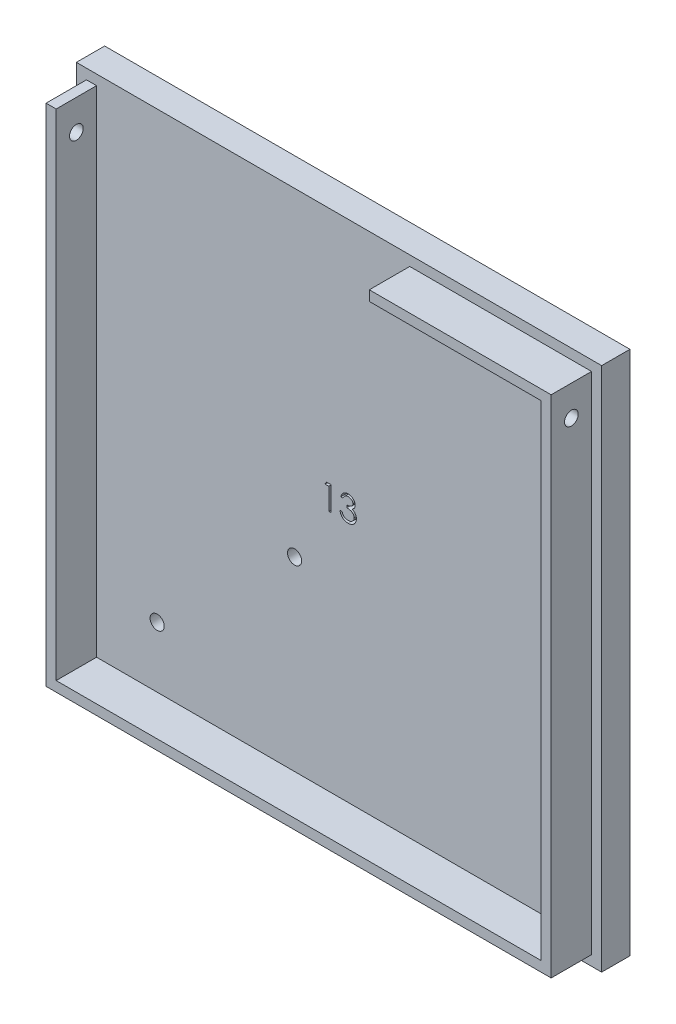
from build123d import *

# Parameters (mm, degrees)
CROQUIS1_W              = 130
CROQUIS1_H              = 130
CROQUIS1_R              = 1.75
CROQUIS1_R_2            = 2.25
SALIENTE_EXTRUIR1_DEPTH = 7
CORTAR_EXTRUIR1_DEPTH   = 2
CROQUIS4_W              = 125
CROQUIS4_H              = 125
CROQUIS4_W_2            = 120
CROQUIS4_H_2            = 120
SALIENTE_EXTRUIR2_DEPTH = 10
CROQUIS6_R              = 1.7
CORTAR_EXTRUIR2_DEPTH   = 145.118874545
CORTAR_EXTRUIR3_REACH   = 146.119
CROQUIS7_W              = 77.5
CROQUIS7_H              = 10


with BuildPart() as part:
    # Croquis1 → Saliente-Extruir1 (new body)
    with BuildSketch(Plane.XY):
        Rectangle(CROQUIS1_W, CROQUIS1_H)
        with Locations((-11, -14)):
            Circle(CROQUIS1_R, mode=Mode.SUBTRACT)
        with Locations((-45, -45)):
            Circle(CROQUIS1_R, mode=Mode.SUBTRACT)
        with Locations((55, 45)):
            Circle(CROQUIS1_R_2, mode=Mode.SUBTRACT)
        with Locations((55, -45)):
            Circle(CROQUIS1_R_2, mode=Mode.SUBTRACT)
    extrude(amount=SALIENTE_EXTRUIR1_DEPTH)

    # Croquis2 → Cortar-Extruir1 (cut)
    with BuildSketch(Plane.XY.offset(7)):
        Polygon((-3.109375, 6), (-2, 6), (-2, 0), (-2.538461538, 0), (-2.538461538, 5.384615385), (-3.461538462, 5.384615385), align=None)
        with BuildLine():
            Line((1, 4.615384615), (0.461538462, 4.615384615))
            add(Edge.make_bspline(
                [(0.461538462, 4.615384615), (0.476126263, 4.675783159), (0.504644221, 4.793857373), (0.564125775, 4.962555534), (0.628924499, 5.122195856), (0.706734392, 5.269789126), (0.791606542, 5.40830153), (0.888845493, 5.534591458), (0.993965018, 5.651870827), (1.110236359, 5.755950663), (1.232171208, 5.850198199), (1.361487699, 5.93055544), (1.495584088, 5.999682559), (1.635389459, 6.056631528), (1.781320039, 6.099532426), (1.932056536, 6.130658378), (2.087993965, 6.150871717), (2.193846977, 6.152844454), (2.247596154, 6.153846154)],
                knots=[0, 0, 0, 0, 1.162005537, 2.271625781, 3.343758855, 4.383309926, 5.390229558, 6.379919256, 7.361854164, 8.333198761, 9.295911338, 10.242430842, 11.177959212, 12.116337295, 13.062827104, 14.020064771, 14.994644689, 16, 16, 16, 16], degree=3))
            add(Edge.make_bspline(
                [(2.247596154, 6.153846154), (2.325909426, 6.151481759), (2.48082773, 6.146804544), (2.708421525, 6.104094082), (2.927896072, 6.03650814), (3.136849069, 5.943124608), (3.33093781, 5.827946357), (3.503628416, 5.690863951), (3.652580149, 5.534522291), (3.777541939, 5.361837895), (3.875384795, 5.177285593), (3.947532863, 4.987342467), (3.991455745, 4.792459087), (3.997148128, 4.66087518), (4, 4.594951923)],
                knots=[0, 0, 0, 0, 1.083050992, 2.142477498, 3.193116406, 4.255571735, 5.30263384, 6.308962982, 7.297363603, 8.282367274, 9.249857812, 10.179914175, 11.08814088, 12, 12, 12, 12], degree=3))
            add(Edge.make_bspline(
                [(4, 4.594951923), (3.998005272, 4.531511704), (3.9941019, 4.407369039), (3.960958405, 4.226132187), (3.905181954, 4.055318015), (3.827919504, 3.894207451), (3.727905418, 3.743822011), (3.606752223, 3.603823341), (3.463604803, 3.473590499), (3.355126624, 3.398985688), (3.299278846, 3.360576923)],
                knots=[0, 0, 0, 0, 1.024540389, 2.004866551, 2.965041327, 3.920577974, 4.882998113, 5.874504559, 6.905732034, 8, 8, 8, 8], degree=3))
            add(Edge.make_bspline(
                [(3.299278846, 3.360576923), (3.363104711, 3.3297572), (3.48956221, 3.268694416), (3.661934546, 3.148941689), (3.818410904, 3.010673665), (3.905674422, 2.902771974), (3.949519231, 2.848557692)],
                knots=[0, 0, 0, 0, 1.015518401, 2.012035669, 3.001164323, 4, 4, 4, 4], degree=3))
            add(Edge.make_bspline(
                [(3.949519231, 2.848557692), (3.978390103, 2.809030118), (4.035659068, 2.730622261), (4.106348554, 2.604559817), (4.170478465, 2.477100121), (4.220450269, 2.344826853), (4.259148327, 2.209273116), (4.286810096, 2.070206151), (4.303994338, 1.927512398), (4.306455284, 1.830976718), (4.307692308, 1.782451923)],
                knots=[0, 0, 0, 0, 1.025084078, 2.033381695, 3.024893161, 4.013698104, 4.991890475, 5.976764909, 6.982997093, 8, 8, 8, 8], degree=3))
            add(Edge.make_bspline(
                [(4.307692308, 1.782451923), (4.304615999, 1.698435258), (4.298477858, 1.530797312), (4.243613731, 1.283126361), (4.158562461, 1.0410255), (4.037779142, 0.809468632), (3.890577699, 0.592816551), (3.715450857, 0.39897145), (3.514388443, 0.232345271), (3.290150187, 0.093127737), (3.047206539, -0.01816013), (2.787362667, -0.09540146), (2.514362574, -0.145708888), (2.327150064, -0.151103521), (2.231971154, -0.153846154)],
                knots=[0, 0, 0, 0, 0.955779014, 1.907060117, 2.875433937, 3.871313158, 4.872415639, 5.851225146, 6.836215519, 7.83643374, 8.849228613, 9.86973379, 10.916971861, 12, 12, 12, 12], degree=3))
            add(Edge.make_bspline(
                [(2.231971154, -0.153846154), (2.167823782, -0.152357788), (2.041603145, -0.149429181), (1.856042862, -0.129408722), (1.678919949, -0.092842999), (1.509994924, -0.043637332), (1.349117718, 0.018748511), (1.196779252, 0.096437708), (1.052042292, 0.187828854), (0.916272662, 0.294000719), (0.789486545, 0.41276873), (0.675053304, 0.546241319), (0.571065087, 0.691951154), (0.480306278, 0.851590679), (0.398642931, 1.023096834), (0.331475577, 1.208665688), (0.272357459, 1.406638298), (0.24487152, 1.544600138), (0.230769231, 1.615384615)],
                knots=[0, 0, 0, 0, 1.048658725, 2.063410685, 3.046034179, 4.001477787, 4.936774919, 5.862367409, 6.792675028, 7.730719943, 8.675894397, 9.627829632, 10.600096036, 11.597688215, 12.626045268, 13.701542398, 14.82072376, 16, 16, 16, 16], degree=3))
            Line((0.230769231, 1.615384615), (0.769230769, 1.615384615))
            add(Edge.make_bspline(
                [(0.769230769, 1.615384615), (0.783259269, 1.569186307), (0.810545919, 1.479326584), (0.856993287, 1.350000346), (0.909910325, 1.231443683), (0.96667814, 1.122786903), (1.026298333, 1.022959927), (1.093009633, 0.934602437), (1.161871025, 0.853833519), (1.213778488, 0.80832847), (1.239182692, 0.786057692)],
                knots=[0, 0, 0, 0, 1.198163088, 2.33053128, 3.407730985, 4.417276592, 5.372219308, 6.28897303, 7.162600585, 8, 8, 8, 8], degree=3))
            add(Edge.make_bspline(
                [(1.239182692, 0.786057692), (1.272776823, 0.760157691), (1.339861388, 0.708437637), (1.449178356, 0.642434845), (1.564146732, 0.585244516), (1.687257602, 0.54155818), (1.815854352, 0.504567905), (1.952015549, 0.480361301), (2.094539921, 0.463753007), (2.191856087, 0.46228741), (2.241586538, 0.461538462)],
                knots=[0, 0, 0, 0, 0.946170439, 1.889420265, 2.845303464, 3.807233317, 4.801018734, 5.828864929, 6.890507805, 8, 8, 8, 8], degree=3))
            add(Edge.make_bspline(
                [(2.241586538, 0.461538462), (2.2977354, 0.462594299), (2.407529652, 0.464658898), (2.567737982, 0.483645824), (2.72015075, 0.511297962), (2.863075765, 0.554005932), (2.998385206, 0.606773106), (3.12418232, 0.673027515), (3.242118502, 0.750761324), (3.350683197, 0.839114167), (3.448304067, 0.93583673), (3.534257518, 1.037001995), (3.607328367, 1.142183417), (3.666271643, 1.251963053), (3.712815444, 1.365886303), (3.744500931, 1.484272867), (3.766532099, 1.606153895), (3.768326292, 1.689003556), (3.769230769, 1.730769231)],
                knots=[0, 0, 0, 0, 1.217147791, 2.380027433, 3.494444702, 4.572153297, 5.609568379, 6.639424714, 7.649109417, 8.668170816, 9.669597737, 10.625200337, 11.543417969, 12.441394052, 13.322311151, 14.205496177, 15.095365482, 16, 16, 16, 16], degree=3))
            add(Edge.make_bspline(
                [(3.769230769, 1.730769231), (3.766607395, 1.786674383), (3.761373701, 1.898206512), (3.721416136, 2.062293782), (3.655692369, 2.22039106), (3.563682349, 2.369800986), (3.451678243, 2.50827396), (3.320766974, 2.631825073), (3.16986144, 2.7337738), (3.030970236, 2.804211497), (2.907944253, 2.852275055), (2.802660737, 2.884289279), (2.684792274, 2.911398403), (2.555764247, 2.93661944), (2.414604448, 2.958084609), (2.261466554, 2.975984864), (2.096319534, 2.990307791), (1.981991821, 2.996703955), (1.923076923, 3)],
                knots=[0, 0, 0, 0, 1.07054697, 2.135767047, 3.216561865, 4.33974944, 5.486079747, 6.621378074, 7.775625952, 8.963672916, 9.598146892, 10.304877434, 11.070270905, 11.915000392, 12.823868403, 13.805723172, 14.86925407, 16, 16, 16, 16], degree=3))
            Line((1.923076923, 3), (1.923076923, 3.615384615))
            add(Edge.make_bspline(
                [(1.923076923, 3.615384615), (1.997307493, 3.616644279), (2.142706944, 3.61911165), (2.355097181, 3.648953954), (2.558194287, 3.690235031), (2.747497274, 3.753466789), (2.920037925, 3.826907298), (3.069728672, 3.912368228), (3.194472353, 4.007364941), (3.293662761, 4.1133637), (3.368284296, 4.227046639), (3.42284452, 4.345532337), (3.455073651, 4.469859299), (3.459375937, 4.554707301), (3.461538462, 4.597355769)],
                knots=[0, 0, 0, 0, 1.321986639, 2.589447074, 3.816329219, 5.01088745, 6.139805852, 7.153945165, 8.075214402, 8.924034688, 9.728124013, 10.488707548, 11.240355623, 12, 12, 12, 12], degree=3))
            add(Edge.make_bspline(
                [(3.461538462, 4.597355769), (3.460828043, 4.628689047), (3.459414698, 4.691025116), (3.441590793, 4.782096662), (3.414806723, 4.870383998), (3.37798433, 4.955511673), (3.328698275, 5.036889285), (3.269716584, 5.115210626), (3.199485555, 5.190028533), (3.119007646, 5.259766224), (3.032587409, 5.326227773), (2.937873509, 5.382651151), (2.837721723, 5.430899829), (2.732021172, 5.470687547), (2.620428835, 5.500617755), (2.503469021, 5.522107769), (2.380918707, 5.535543748), (2.297310023, 5.537478176), (2.254807692, 5.538461538)],
                knots=[0, 0, 0, 0, 0.884392785, 1.759457502, 2.611959086, 3.489218968, 4.37281399, 5.2945488, 6.255912374, 7.266815255, 8.301784654, 9.332968512, 10.37626691, 11.440494194, 12.520033166, 13.637162961, 14.798855837, 16, 16, 16, 16], degree=3))
            add(Edge.make_bspline(
                [(2.254807692, 5.538461538), (2.186490547, 5.536076346), (2.053051273, 5.531417512), (1.860682844, 5.490612346), (1.6818497, 5.42550706), (1.545154843, 5.347793312), (1.444213288, 5.271078283), (1.372081394, 5.204079906), (1.301246233, 5.129623637), (1.23636793, 5.043123565), (1.170755398, 4.950437639), (1.111021864, 4.846854185), (1.052976678, 4.735075223), (1.018000878, 4.656054136), (1, 4.615384615)],
                knots=[0, 0, 0, 0, 1.472543308, 2.876219568, 4.221790263, 5.565193594, 6.249813518, 6.953379497, 7.687249741, 8.463570142, 9.283606569, 10.136032583, 11.040678096, 12, 12, 12, 12], degree=3))
        make_face()
    extrude(amount=-CORTAR_EXTRUIR1_DEPTH, mode=Mode.SUBTRACT)

    # Croquis4 → Saliente-Extruir2 (add)
    with BuildSketch(Plane.XY.offset(7)):
        Rectangle(CROQUIS4_W, CROQUIS4_H)
        Rectangle(CROQUIS4_W_2, CROQUIS4_H_2, mode=Mode.SUBTRACT)
    extrude(amount=SALIENTE_EXTRUIR2_DEPTH)

    # Croquis6 → Cortar-Extruir2 (cut, through all)
    with BuildSketch(Plane(origin=(62.5, 0, 0), x_dir=(0, 0, -1), z_dir=(1, 0, 0))):
        with Locations((-12, 55)):
            Circle(CROQUIS6_R)
    extrude(amount=-CORTAR_EXTRUIR2_DEPTH, mode=Mode.SUBTRACT)

    # Croquis7 → Cortar-Extruir3 (cut, up to next)
    with BuildSketch(Plane(origin=(0, 62.5, 0), x_dir=(1, 0, 0), z_dir=(0, 1, 0)), mode=Mode.PRIVATE) as cortar_extruir3_sk1:
        with Locations((-21.25, -12)):
            Rectangle(CROQUIS7_W, CROQUIS7_H)
    cortar_extruir3_tool1 = extrude(cortar_extruir3_sk1.sketch, amount=-CORTAR_EXTRUIR3_REACH, mode=Mode.PRIVATE) & part.part
    add(cortar_extruir3_tool1.solids().sort_by_distance((-21.25, 62.5, 12))[0], mode=Mode.SUBTRACT)


solid = part.part
